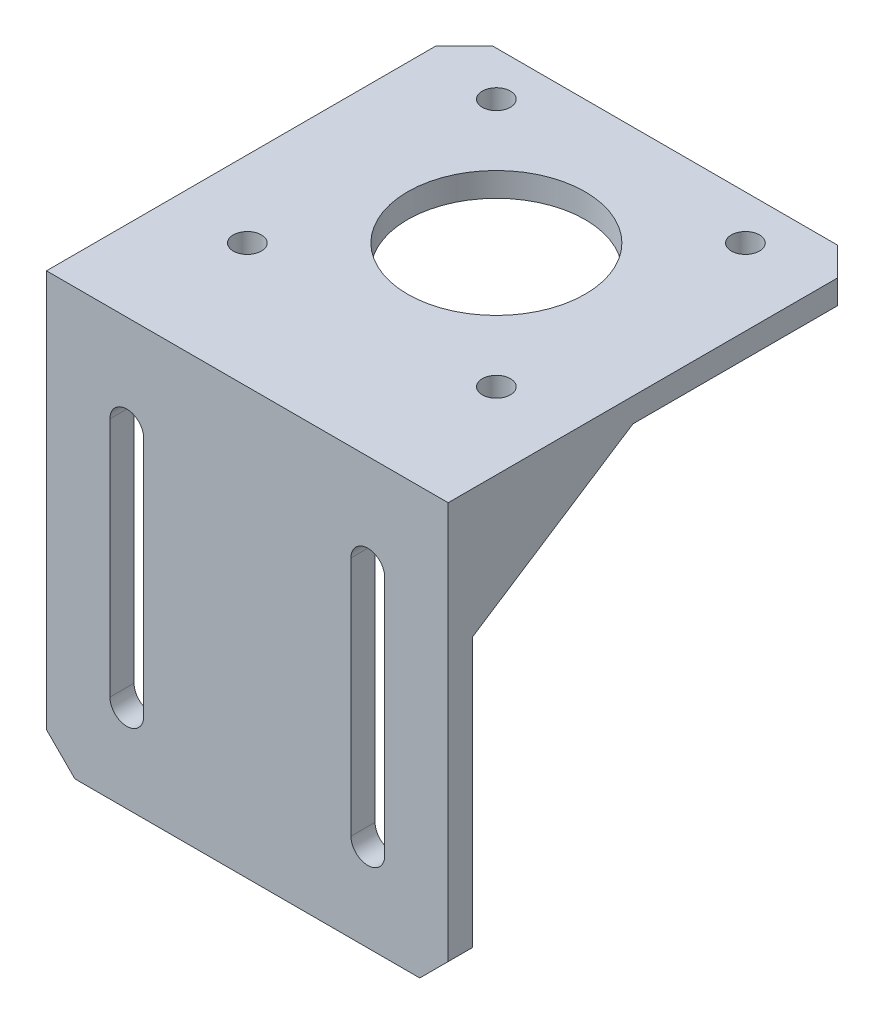
from build123d import *

# Parameters (mm, degrees)
SKETCH_1_R      = 11.05
SKETCH_1_R_2    = 1.75
EXTRUDE_1_DEPTH = 3
EXTRUDE_2_DEPTH = 3
EXTRUDE_3_DEPTH = 3
EXTRUDE_4_DEPTH = 3


with BuildPart() as part:
    # 草图1 → 凸台-拉伸1 (new body)
    with BuildSketch(Plane(origin=(0, 0, 0), x_dir=(1, 0, 0), z_dir=(0, 1, 0))):
        Polygon((0, 0), (0, 45.464466094), (3.535533906, 49), (46.464466094, 49), (50, 45.464466094), (50, 0), align=None)
        with Locations(Location((25, 28, 0), (0, 0, 270))):
            Circle(SKETCH_1_R, mode=Mode.SUBTRACT)
        with Locations(Location((9.5, 12.5, 0), (0, 0, 270))):
            Circle(SKETCH_1_R_2, mode=Mode.SUBTRACT)
        with Locations(Location((9.5, 43.5, 0), (0, 0, 270))):
            Circle(SKETCH_1_R_2, mode=Mode.SUBTRACT)
        with Locations(Location((40.5, 43.5, 0), (0, 0, 270))):
            Circle(SKETCH_1_R_2, mode=Mode.SUBTRACT)
        with Locations(Location((40.5, 12.5, 0), (0, 0, 270))):
            Circle(SKETCH_1_R_2, mode=Mode.SUBTRACT)
    extrude(amount=EXTRUDE_1_DEPTH)

    # 草图2 → 凸台-拉伸2 (add)
    with BuildSketch(Plane.XY):
        Polygon((0, 3), (0, -46.464466094), (3.535533906, -50), (46.464466094, -50), (50, -46.464466094), (50, 3), align=None)
        with BuildLine():
            Line((12.1, -9), (12.1, -39))
            ThreePointArc((12.1, -39), (10, -41.1), (7.9, -39))
            Line((7.9, -39), (7.9, -9))
            ThreePointArc((7.9, -9), (10, -6.9), (12.1, -9))
        make_face(mode=Mode.SUBTRACT)
        with BuildLine():
            Line((37.9, -9), (37.9, -39))
            ThreePointArc((37.9, -39), (40, -41.1), (42.1, -39))
            Line((42.1, -39), (42.1, -9))
            ThreePointArc((42.1, -9), (40, -6.9), (37.9, -9))
        make_face(mode=Mode.SUBTRACT)
    extrude(amount=EXTRUDE_2_DEPTH)

    # 草图3 → 凸台-拉伸3 (add)
    with BuildSketch(Plane(origin=(50, 0, 0), x_dir=(0, 0, -1), z_dir=(1, 0, 0))):
        Polygon((0, 0), (0, -13), (20, 0), align=None)
    extrude(amount=-EXTRUDE_3_DEPTH)

    # 草图4 → 凸台-拉伸4 (add)
    with BuildSketch(Plane.ZY):
        Polygon((-20, 0), (0, 0), (0, -13), align=None)
    extrude(amount=-EXTRUDE_4_DEPTH)


solid = part.part
